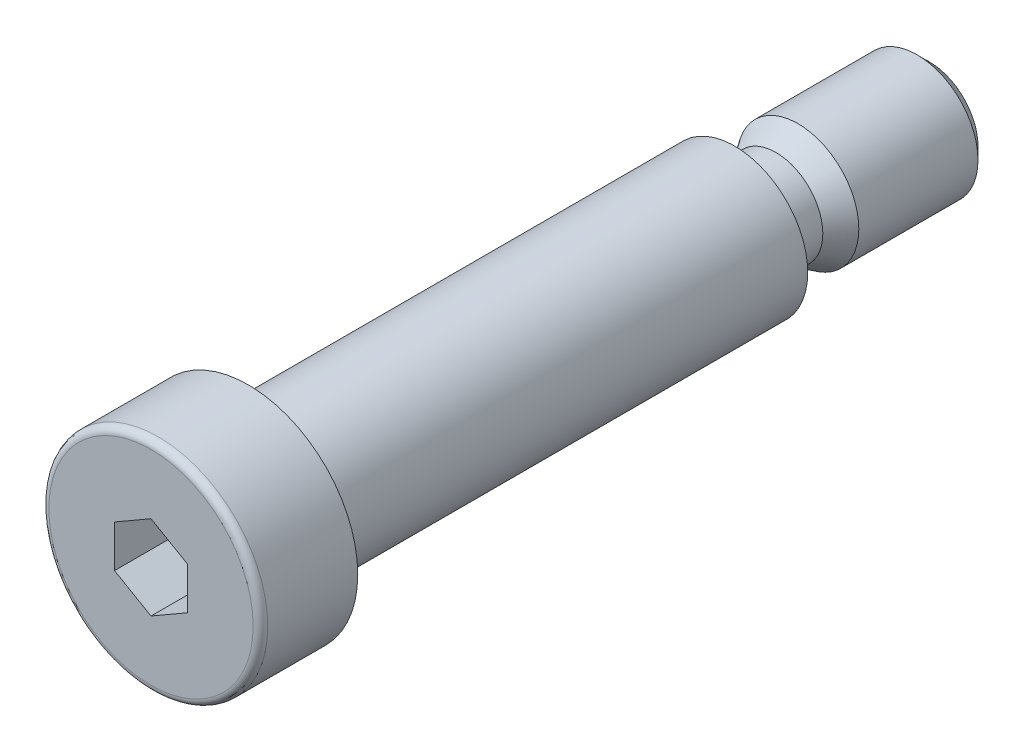
from build123d import *

# Parameters (mm, degrees)
SZKIC1_W                   = 3.85
SZKIC1_H                   = 3.39
WYTNIJ_WYCI_GNI_CIE1_DEPTH = 4.9
ZAOKR_GLENIE1_R            = 0.6


with BuildPart() as part:
    # Szkic1 → Obrót1 (revolve)
    with BuildSketch(Plane(origin=(0, 0, 0), x_dir=(1, 0, 0), z_dir=(0, 1, 0)), mode=Mode.PRIVATE) as obr_t1_sk:
        Polygon((0, -28), (0, -20), (-6, -20), (-9, -20), (-9, -28), align=None)
        Polygon((0, -20), (0, 20), (-3.85, 20), (-6, 20), (-6, -20), align=None)
        with Locations((-1.925, 21.695)):
            Rectangle(SZKIC1_W, SZKIC1_H)
        Polygon((-3.85, 23.39), (0, 23.39), (0, 36), (-4, 36), (-5, 35), (-5, 25.2), align=None)
    revolve(obr_t1_sk.sketch.rotate(Axis((0, 0, 28), (0, 0, -1)), 180), axis=Axis((0, 0, 28), (0, 0, -1)))

    # Szkic2 → Wytnij-wyciągnięcie1 (cut)
    with BuildSketch(Plane.XY.offset(28)):
        Polygon((3, 1.732050808), (0, 3.464101615), (-3, 1.732050808), (-3, -1.732050808), (0, -3.464101615), (3, -1.732050808), align=None)
    extrude(amount=-WYTNIJ_WYCI_GNI_CIE1_DEPTH, mode=Mode.SUBTRACT)

    # Zaokrąglenie1
    zaokr_glenie1_edges = [part.edges().sort_by_distance(p)[0] for p in [
        (-9, 0, 28),
    ]]
    fillet(zaokr_glenie1_edges, radius=ZAOKR_GLENIE1_R)


solid = part.part
